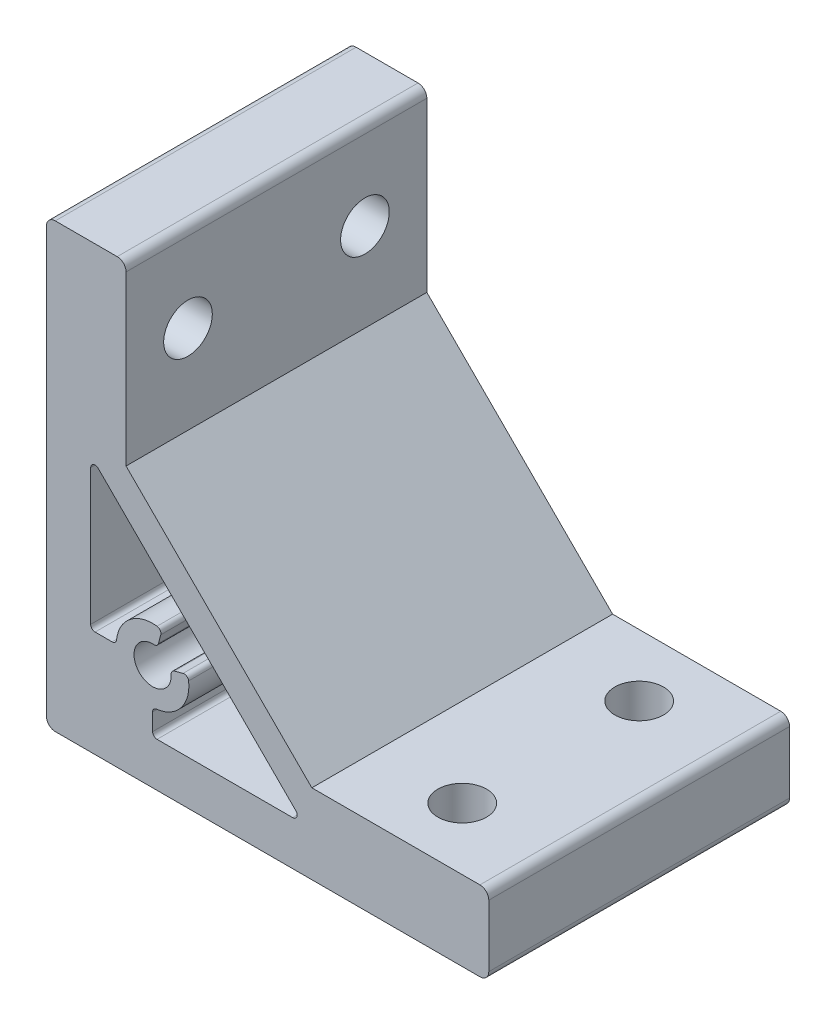
from build123d import *

# Parameters (mm, degrees)
EXTRUDE_11_DEPTH     = 34
SKETCH_32_R          = 2.75
CUT_EXTRUDE_21_DEPTH = 74.054773971
SKETCH_33_R          = 2.75
CUT_EXTRUDE_22_DEPTH = 74.054773971


with BuildPart() as part:
    # 草图31 → 凸台-拉伸11 (new body)
    with BuildSketch(Plane.XY):
        with BuildLine():
            Line((9, 30), (9, 49))
            ThreePointArc((9, 49), (8.707106781, 49.707106781), (8, 50))
            Line((8, 50), (1, 50))
            ThreePointArc((1, 50), (0.292893219, 49.707106781), (0, 49))
            Line((0, 49), (0, 1))
            ThreePointArc((0, 1), (0.292893219, 0.292893219), (1, 0))
            Line((1, 0), (49, 0))
            ThreePointArc((49, 0), (49.707106781, 0.292893219), (50, 1))
            Line((50, 1), (50, 8))
            ThreePointArc((50, 8), (49.707106781, 8.707106781), (49, 9))
            Line((49, 9), (30, 9))
            Line((30, 9), (9, 30))
        make_face()
        with BuildLine():
            Line((5.5, 12), (7.428034206, 12))
            ThreePointArc((7.428034206, 12), (7.761575809, 12.12750839), (7.925, 12.445000002))
            ThreePointArc((7.925, 12.445000002), (9.455281372, 15.213766146), (12.501000023, 16.068999997))
            ThreePointArc((12.501000023, 16.068999997), (12.854580588, 15.852403205), (12.923122843, 15.443459021))
            Line((12.923122843, 15.443459021), (12.661152875, 14.464571239))
            ThreePointArc((12.661152875, 14.464571239), (12.468861163, 14.187031274), (12.143999993, 14.095))
            ThreePointArc((12.143999993, 14.095), (10.514573143, 10.515407625), (14.095, 12.143000006))
            ThreePointArc((14.095, 12.143000006), (14.186987516, 12.467511304), (14.464129015, 12.659766017))
            Line((14.464129015, 12.659766017), (15.443998772, 12.92299967))
            ThreePointArc((15.443998772, 12.92299967), (15.853205766, 12.854713962), (16.069999999, 12.501000008))
            ThreePointArc((16.069999999, 12.501000008), (15.215158243, 9.454636454), (12.446, 7.924))
            ThreePointArc((12.446, 7.924), (12.127844119, 7.76084071), (12, 7.426924553))
            Line((12, 7.426924553), (12, 5.5))
            ThreePointArc((12, 5.5), (12.146446609, 5.146446609), (12.5, 5))
            Line((12.5, 5), (27.842893456, 5))
            ThreePointArc((27.842893456, 5), (28.30483088, 5.308653143), (28.196454654, 5.853545371))
            Line((28.196454654, 5.853545371), (5.853561034, 28.197438986))
            ThreePointArc((5.853561034, 28.197438986), (5.308663433, 28.305835138), (5, 27.843893575))
            Line((5, 27.843893575), (5, 12.5))
            ThreePointArc((5, 12.5), (5.146446609, 12.146446609), (5.5, 12))
        make_face(mode=Mode.SUBTRACT)
    extrude(amount=-EXTRUDE_11_DEPTH)

    # 草图32 → 切除-拉伸21 (cut, through all)
    with BuildSketch(Plane(origin=(0, 9, 0), x_dir=(1, 0, 0), z_dir=(0, 1, 0))):
        with Locations((40, 27)):
            Circle(SKETCH_32_R)
        with Locations((40, 7)):
            Circle(SKETCH_32_R)
    extrude(amount=-CUT_EXTRUDE_21_DEPTH, mode=Mode.SUBTRACT)

    # 草图33 → 切除-拉伸22 (cut, through all)
    with BuildSketch(Plane(origin=(9, 0, 0), x_dir=(0, 0, -1), z_dir=(1, 0, 0))):
        with Locations((7, 40)):
            Circle(SKETCH_33_R)
        with Locations((27, 40)):
            Circle(SKETCH_33_R)
    extrude(amount=-CUT_EXTRUDE_22_DEPTH, mode=Mode.SUBTRACT)


solid = part.part
